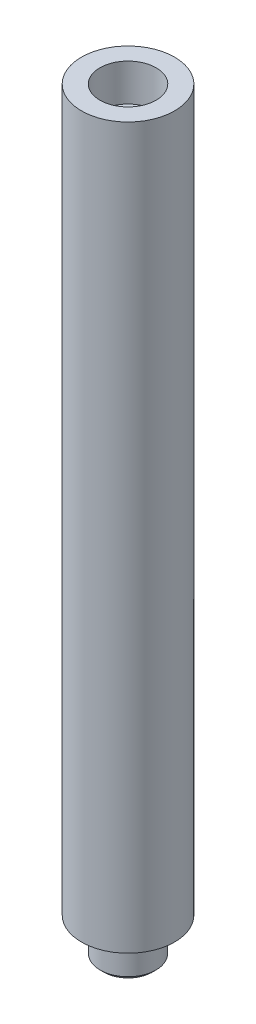
from build123d import *

# Parameters (mm, degrees)
CHAMFER1_SIZE = 1
CHAMFER2_SIZE = 1


with BuildPart() as part:
    # Sketch1 → Revolve1 (revolve)
    with BuildSketch(Plane.XY, mode=Mode.PRIVATE) as revolve1_sk:
        Polygon((4, 0), (4, 193.2), (7.55, 193.2), (7.55, 203.2), (12.5, 203.2), (12.5, 10), (7.5, 10), (7.5, 0), align=None)
    revolve(revolve1_sk.sketch.rotate(Axis((0, 0, 0), (0, 1, 0)), 90), axis=Axis((0, 0, 0), (0, 1, 0)))

    # Chamfer1
    chamfer1_edges = [part.edges().sort_by_distance(p)[0] for p in [
        (0, 193.2, 4),
    ]]
    chamfer(chamfer1_edges, length=CHAMFER1_SIZE)

    # Chamfer2
    chamfer2_edges = [part.edges().sort_by_distance(p)[0] for p in [
        (0, 0, 7.5),
    ]]
    chamfer(chamfer2_edges, length=CHAMFER2_SIZE)


solid = part.part
